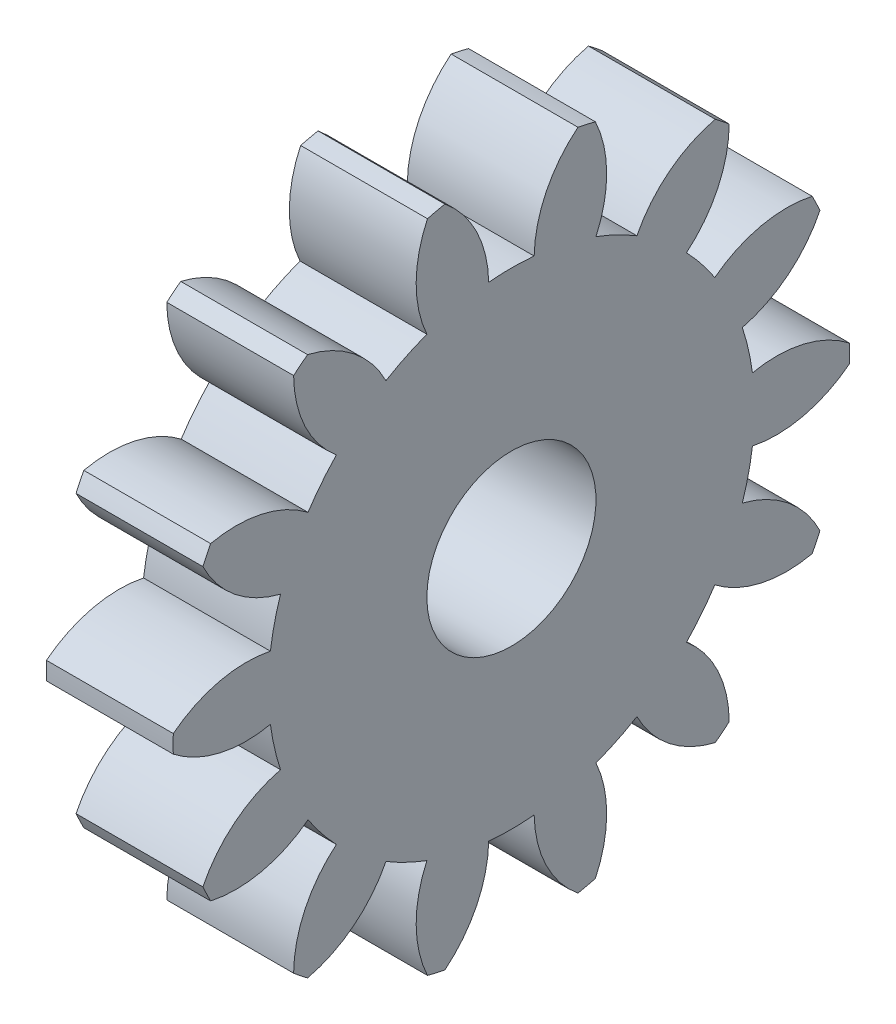
from build123d import *

# Parameters (mm, degrees)
BASPROSKE_W     = 3.75
BASPROSKE_H     = 10
TOOTHCUT_DEPTH  = 15.630874888
TEETHCUTS_COUNT = 14
TEETHCUTS_ANGLE = 334.285714286
BORSKE_R        = 2.5
BORE_DEPTH      = 50.0000508


with BuildPart() as part:
    # BasProSke → Base-Revolve (revolve)
    with BuildSketch(Plane(origin=(0, 0, 0), x_dir=(1, 0, 0), z_dir=(0, 1, 0)), mode=Mode.PRIVATE) as base_revolve_sk:
        with Locations((1.875, 5)):
            Rectangle(BASPROSKE_W, BASPROSKE_H)
    revolve(base_revolve_sk.sketch.rotate(Axis((-10, 0, 0), (1, 0, 0)), 180), axis=Axis((-10, 0, 0), (1, 0, 0)))

    # TooCutSke → ToothCut (cut, through all)
    with BuildSketch(Plane(origin=(0, 0, 0), x_dir=(0, 0, -1), z_dir=(1, 0, 0))):
        with BuildLine():
            ThreePointArc((0.671900202, 7.155021479), (0, 7.1865), (-0.671900202, 7.155021479))
            ThreePointArc((-0.671900202, 7.155021479), (-1.034144542, 8.637744921), (-1.992992839, 9.825305324))
            ThreePointArc((-1.992992839, 9.825305324), (0, 10.0254), (1.992992839, 9.825305324))
            ThreePointArc((1.992992839, 9.825305324), (1.034144542, 8.637744921), (0.671900202, 7.155021479))
        make_face()
    toothcut = extrude(amount=TOOTHCUT_DEPTH, mode=Mode.SUBTRACT)

    # TeethCuts: ToothCut ×14 about axis
    teethcuts_axis = Axis((-10, 0, 0), (1, 0, 0))
    for i in range(1, TEETHCUTS_COUNT):
        add(toothcut.rotate(teethcuts_axis, i * TEETHCUTS_ANGLE / (TEETHCUTS_COUNT - 1)), mode=Mode.SUBTRACT)

    # BorSke → Bore (cut, symmetric)
    with BuildSketch(Plane(origin=(0, 0, 0), x_dir=(0, 0, -1), z_dir=(1, 0, 0))):
        with Locations(Location((0, 0, 0), (0, 0, 180))):
            Circle(BORSKE_R)
    extrude(amount=BORE_DEPTH, both=True, mode=Mode.SUBTRACT)


solid = part.part
